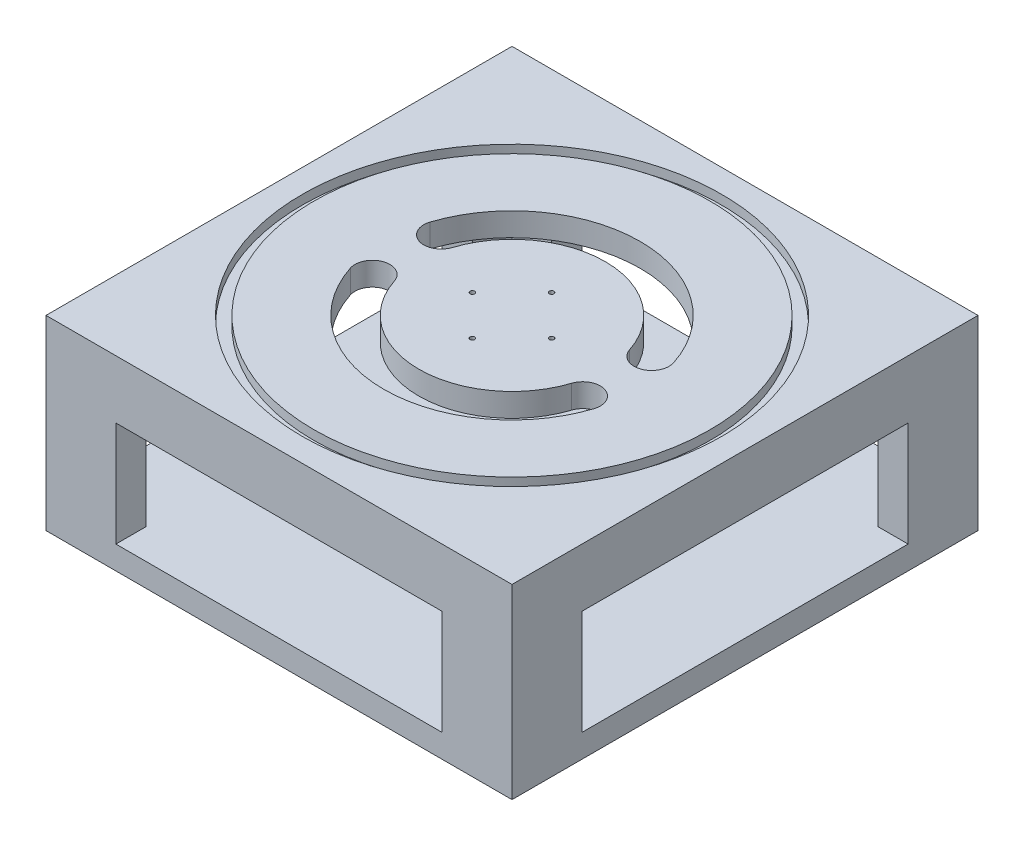
from build123d import *

# Parameters (mm, degrees)
SKETCH2_W                = 200
SKETCH2_H                = 200
BOSS_EXTRUDE1_DEPTH      = 10
SKETCH12_R               = 90
SKETCH12_R_2             = 85
CUT_EXTRUDE8_DEPTH       = 4
SKETCH13_R               = 1
CUT_EXTRUDE9_DEPTH       = 142.774468788
SKETCH4_W                = 200
SKETCH4_H                = 200
SKETCH4_W_2              = 174
SKETCH4_H_2              = 174
BOSS_EXTRUDE4_DEPTH      = 60
CUT_EXTRUDE10_DEPTH      = 232.516738056
CUT_EXTRUDE10_DEPTH_BACK = 232.516738056
CUT_EXTRUDE11_DEPTH      = 232.516738056
CUT_EXTRUDE11_DEPTH_BACK = 232.516738056
CUT_EXTRUDE12_DEPTH      = 10
SKETCH19_W               = 200
SKETCH19_H               = 200
BOSS_EXTRUDE5_DEPTH      = 10


with BuildPart() as part:
    # Sketch2 → Boss-Extrude1 (new body)
    with BuildSketch(Plane(origin=(0, 0, 0), x_dir=(1, 0, 0), z_dir=(0, 1, 0))):
        Rectangle(SKETCH2_W, SKETCH2_H)
    extrude(amount=BOSS_EXTRUDE1_DEPTH)

    # Sketch12 → Cut-Extrude8 (cut)
    with BuildSketch(Plane(origin=(0, 10, 0), x_dir=(1, 0, 0), z_dir=(0, 1, 0))):
        with Locations(Location((0, 0, 0), (0, 0, 270))):
            Circle(SKETCH12_R)
        with Locations(Location((0, 0, 0), (0, 0, 270))):
            Circle(SKETCH12_R_2, mode=Mode.SUBTRACT)
    extrude(amount=-CUT_EXTRUDE8_DEPTH, mode=Mode.SUBTRACT)

    # Sketch13 → Cut-Extrude9 (cut, through all)
    with BuildSketch(Plane(origin=(0, 10, 0), x_dir=(1, 0, 0), z_dir=(0, 1, 0))):
        with Locations(Location((0, 17, 0), (0, 0, 270))):
            Circle(SKETCH13_R)
        with Locations(Location((17, 0, 0), (0, 0, 270))):
            Circle(SKETCH13_R)
        with Locations(Location((0, -17, 0), (0, 0, 270))):
            Circle(SKETCH13_R)
        with Locations(Location((-17, 0, 0), (0, 0, 270))):
            Circle(SKETCH13_R)
    extrude(amount=-CUT_EXTRUDE9_DEPTH, mode=Mode.SUBTRACT)

    # Sketch4 → Boss-Extrude4 (add)
    with BuildSketch(Plane.XZ):
        Rectangle(SKETCH4_W, SKETCH4_H)
        Rectangle(SKETCH4_W_2, SKETCH4_H_2, mode=Mode.SUBTRACT)
    extrude(amount=BOSS_EXTRUDE4_DEPTH)

    # Sketch14 → Cut-Extrude10 (cut, two sides: drawn at the far end of the back side and taken through both)
    with BuildSketch(Plane.XY.offset(100).offset(-CUT_EXTRUDE10_DEPTH_BACK)):
        Polygon((0, -15), (70, -15), (70, -60), (-70, -60), (-70, -15), align=None)
    extrude(amount=CUT_EXTRUDE10_DEPTH + CUT_EXTRUDE10_DEPTH_BACK, mode=Mode.SUBTRACT)

    # Sketch15 → Cut-Extrude11 (cut, two sides: drawn at the far end of the back side and taken through both)
    with BuildSketch(Plane.ZY.offset(100).offset(-CUT_EXTRUDE11_DEPTH_BACK)):
        Polygon((0, -60), (-70, -60), (-70, -15), (70, -15), (70, -60), align=None)
    extrude(amount=CUT_EXTRUDE11_DEPTH + CUT_EXTRUDE11_DEPTH_BACK, mode=Mode.SUBTRACT)

    # Sketch3 → Cut-Extrude12 (cut)
    with BuildSketch(Plane(origin=(0, 10, 0), x_dir=(1, 0, 0), z_dir=(0, 1, 0))):
        with BuildLine():
            ThreePointArc((-38.01797101, -12.435187183), (0, -40), (38.01797101, -12.435187183))
            ThreePointArc((38.01797101, -12.435187183), (47.477938171, -7.638415216), (52.274710139, -17.098382377))
            ThreePointArc((52.274710139, -17.098382377), (0, -55), (-52.274710139, -17.098382377))
            ThreePointArc((-52.274710139, -17.098382377), (-47.477938171, -7.638415216), (-38.01797101, -12.435187183))
        make_face()
        with BuildLine():
            ThreePointArc((38.01797101, 12.435187183), (47.477938171, 7.638415216), (52.274710139, 17.098382377))
            ThreePointArc((52.274710139, 17.098382377), (0, 55), (-52.274710139, 17.098382377))
            ThreePointArc((-52.274710139, 17.098382377), (-47.477938171, 7.638415216), (-38.01797101, 12.435187183))
            ThreePointArc((-38.01797101, 12.435187183), (0, 40), (38.01797101, 12.435187183))
        make_face()
    extrude(amount=-CUT_EXTRUDE12_DEPTH, mode=Mode.SUBTRACT)

    # Sketch19 → Boss-Extrude5 (add)
    with BuildSketch(Plane.XZ.offset(60)):
        Rectangle(SKETCH19_W, SKETCH19_H)
    extrude(amount=BOSS_EXTRUDE5_DEPTH)


solid = part.part
